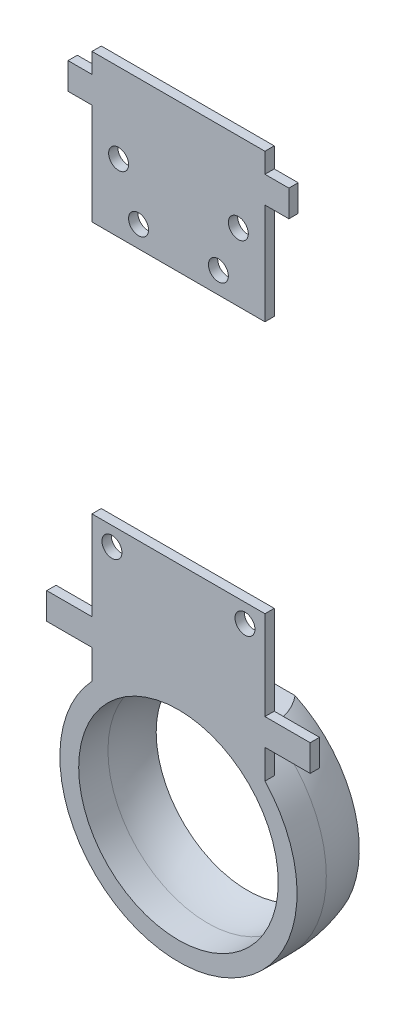
from build123d import *

# Parameters (mm, degrees)
SKETCH1_R               = 3.75
SKETCH1_W               = 65
SKETCH1_H               = 7.5
SKETCH1_W_2             = 9
SKETCH1_H_2             = 10
SKETCH1_W_3             = 4.5
SKETCH1_W_4             = 12.5
BOSS_EXTRUDE1_DEPTH     = 3.5
CUT_EXTRUDE1_DEPTH      = 248.561103568
CUT_EXTRUDE1_DEPTH_BACK = 248.561103568
SKETCH3_W               = 40.007477242
SKETCH3_H               = 30.684168747
BOSS_EXTRUDE2_DEPTH     = 3.75
SKETCH5_W               = 110
SKETCH5_H               = 95
CUT_EXTRUDE2_DEPTH      = 50


with BuildPart() as part:
    # Sketch1 → Boss-Extrude1 (new body)
    # profile 1 of 9: a face of its own
    with BuildSketch(Plane.XY):
        Polygon((10, 98.461538462), (10, 161.538461538), (32.5, 174.528842595), (32.5, 215), (32.5, 225), (-32.5, 225), (-32.5, 215), (-32.5, 174.528842595), (-10, 161.538461538), (-10, 98.461538462), (-32.5, 90.272208191), (-32.5, 48.5), (-32.5, 38.5), (-32.5, 35), (32.5, 35), (32.5, 38.5), (32.5, 48.5), (32.5, 90.272208191), align=None)
        with Locations((-25, 75)):
            Circle(SKETCH1_R, mode=Mode.SUBTRACT)
        with Locations((25, 75)):
            Circle(SKETCH1_R, mode=Mode.SUBTRACT)
        with Locations((-15, 185)):
            Circle(SKETCH1_R, mode=Mode.SUBTRACT)
        with Locations((-22.5, 202.5)):
            Circle(SKETCH1_R, mode=Mode.SUBTRACT)
        with Locations((15, 185)):
            Circle(SKETCH1_R, mode=Mode.SUBTRACT)
        with Locations((22.5, 202.5)):
            Circle(SKETCH1_R, mode=Mode.SUBTRACT)
    # profile 2 of 9: a face of its own
    with BuildSketch(Plane.XY):
        with Locations((0, 228.75)):
            Rectangle(SKETCH1_W, SKETCH1_H)
    # profile 3 of 9: a face of its own
    with BuildSketch(Plane.XY):
        with BuildLine():
            Line((32.5, 27.5), (32.5, 35))
            Line((32.5, 35), (-32.5, 35))
            Line((-32.5, 35), (-32.5, 27.5))
            ThreePointArc((-32.5, 27.5), (0, -47.570169396), (32.5, 27.5))
        make_face()
        with BuildLine():
            ThreePointArc((3, -40.379807383), (0, -40.5), (-3, -40.379807383))
            ThreePointArc((-3, -40.379807383), (-26.516504294, -29.516504294), (-37.379807383, -6))
            ThreePointArc((-37.379807383, -6), (-37.5, -3), (-37.379807383, 0))
            ThreePointArc((-37.379807383, 0), (-26.516504294, 23.516504294), (-3, 34.379807383))
            ThreePointArc((-3, 34.379807383), (0, 34.5), (3, 34.379807383))
            ThreePointArc((3, 34.379807383), (26.516504294, 23.516504294), (37.379807383, 0))
            ThreePointArc((37.379807383, 0), (37.469939798, -1.498796627), (37.5, -3))
            ThreePointArc((37.5, -3), (37.469939798, -4.501203373), (37.379807383, -6))
            ThreePointArc((37.379807383, -6), (26.516504294, -29.516504294), (3, -40.379807383))
        make_face(mode=Mode.SUBTRACT)
    # profile 4 of 9: a face of its own
    with BuildSketch(Plane.XY):
        with Locations((-37, 220)):
            Rectangle(SKETCH1_W_2, SKETCH1_H_2)
    # profile 5 of 9: a face of its own
    with BuildSketch(Plane.XY):
        with Locations((37, 220)):
            Rectangle(SKETCH1_W_2, SKETCH1_H_2)
    # profile 6 of 9: a face of its own
    with BuildSketch(Plane.XY):
        with Locations((-47.25, 43.5)):
            Rectangle(SKETCH1_W_3, SKETCH1_H_2)
    # profile 7 of 9: a face of its own
    with BuildSketch(Plane.XY):
        with Locations((-38.75, 43.5)):
            Rectangle(SKETCH1_W_4, SKETCH1_H_2)
    # profile 8 of 9: a face of its own
    with BuildSketch(Plane.XY):
        with Locations((38.75, 43.5)):
            Rectangle(SKETCH1_W_4, SKETCH1_H_2)
    # profile 9 of 9: a face of its own
    with BuildSketch(Plane.XY):
        with Locations((47.25, 43.5)):
            Rectangle(SKETCH1_W_3, SKETCH1_H_2)
    extrude(amount=BOSS_EXTRUDE1_DEPTH)

    # Sketch2 → Revolve1 (revolve)
    with BuildSketch(Plane(origin=(0, 0, 0), x_dir=(0, 0, -1), z_dir=(1, 0, 0)), mode=Mode.PRIVATE) as revolve1_sk:
        with BuildLine():
            Line((22.5, 31.369317712), (22.5, 38.970227543))
            Line((22.5, 38.970227543), (0, 38.970227543))
            Line((0, 38.970227543), (0, 34.5))
            Line((0, 34.5), (7.5, 34.5))
            ThreePointArc((7.5, 34.5), (15.161611638, 33.708986735), (22.5, 31.369317712))
        make_face()
        with BuildLine():
            ThreePointArc((7.5, -47.570169396), (15.111827928, -46.915374023), (22.5, -44.970227543))
            Line((22.5, -44.970227543), (22.5, -37.369317712))
            ThreePointArc((22.5, -37.369317712), (15.161611638, -39.708986735), (7.5, -40.5))
            Line((7.5, -40.5), (0, -40.5))
            Line((0, -40.5), (0, -47.570169396))
            Line((0, -47.570169396), (7.5, -47.570169396))
        make_face()
    revolve(revolve1_sk.sketch.rotate(Axis((0, -3, 0), (0, 0, -1)), 90), axis=Axis((0, -3, 0), (0, 0, -1)))

    # Sketch3 → Cut-Extrude1 (cut, two sides: drawn at the far end of the back side and taken through both)
    with BuildSketch(Plane(origin=(32.5, 0, 0), x_dir=(0, 0, -1), z_dir=(1, 0, 0)).offset(-CUT_EXTRUDE1_DEPTH_BACK)):
        with Locations((20.003738621, 50.342084374)):
            Rectangle(SKETCH3_W, SKETCH3_H)
    extrude(amount=CUT_EXTRUDE1_DEPTH + CUT_EXTRUDE1_DEPTH_BACK, mode=Mode.SUBTRACT)

    # Sketch4 → Boss-Extrude2 (add, symmetric)
    with BuildSketch(Plane(origin=(0, 130, 0), x_dir=(1, 0, 0), z_dir=(0, 1, 0))):
        Polygon((50, -3.5), (50, 26.5), (45, 26.5), (45, 0), (10, 0), (10, -3.5), align=None)
    boss_extrude2 = extrude(amount=BOSS_EXTRUDE2_DEPTH, both=True)

    # Mirror1: Boss-Extrude2 across plane
    add(boss_extrude2.mirror(Plane(origin=(0, 0, 0), x_dir=(0, 0, 1), z_dir=(1, 0, 0))))

    # Sketch5 → Cut-Extrude2 (cut)
    with BuildSketch(Plane.XY.offset(3.5)):
        with Locations((0.095917122, 129.477753892)):
            Rectangle(SKETCH5_W, SKETCH5_H)
    extrude(amount=-CUT_EXTRUDE2_DEPTH, mode=Mode.SUBTRACT)


with BuildPart() as cut_extrude2_piece_1:
    # of the separate pieces the step leaves, piece 1, a body of its own (cut_extrude2_pieces)
    add(part.part.solids().sort_by_distance((32.5, 81.977753892, 3.5))[0])


with BuildPart() as cut_extrude2_piece_2:
    # of the separate pieces the step leaves, piece 2, a body of its own (cut_extrude2_pieces)
    add(part.part.solids().sort_by_distance((-32.5, 176.977753892, 3.5))[0])


solid = Compound([cut_extrude2_piece_1.part, cut_extrude2_piece_2.part])
